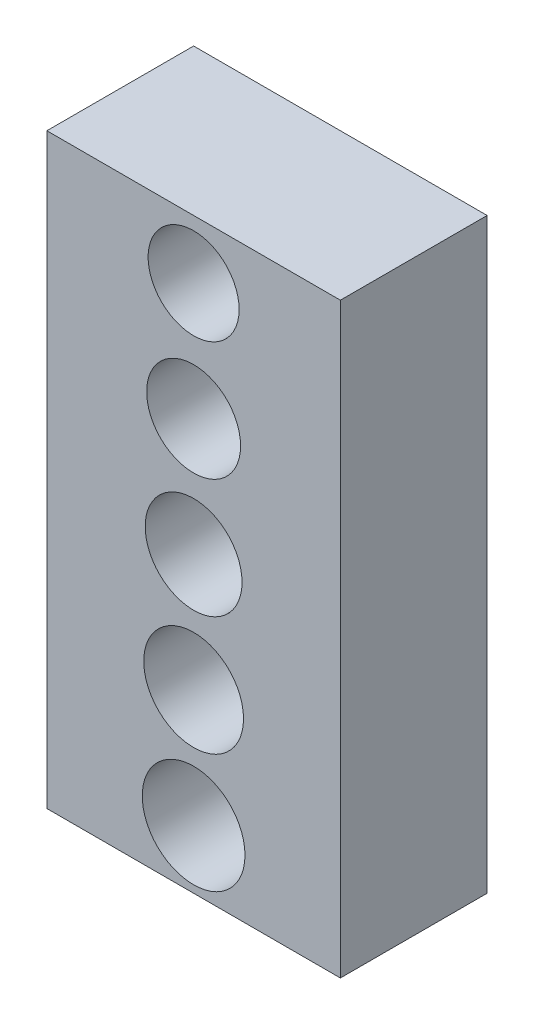
from build123d import *

# Parameters (mm, degrees)
SKETCH_1_W      = 10
SKETCH_1_H      = 20
SKETCH_1_R      = 1.55
SKETCH_1_R_2    = 1.75
SKETCH_1_R_3    = 1.65
SKETCH_1_R_4    = 1.7
SKETCH_1_R_5    = 1.6
EXTRUDE_1_DEPTH = 5


with BuildPart() as part:
    # ｽｹｯﾁ1 → ﾎﾞｽ - 押し出し1 (new body)
    with BuildSketch(Plane.XY):
        Rectangle(SKETCH_1_W, SKETCH_1_H)
        with Locations((0, 8)):
            Circle(SKETCH_1_R, mode=Mode.SUBTRACT)
        with Locations((0, -8)):
            Circle(SKETCH_1_R_2, mode=Mode.SUBTRACT)
        Circle(SKETCH_1_R_3, mode=Mode.SUBTRACT)
        with Locations((0, -4)):
            Circle(SKETCH_1_R_4, mode=Mode.SUBTRACT)
        with Locations((0, 4)):
            Circle(SKETCH_1_R_5, mode=Mode.SUBTRACT)
    extrude(amount=EXTRUDE_1_DEPTH)


solid = part.part
